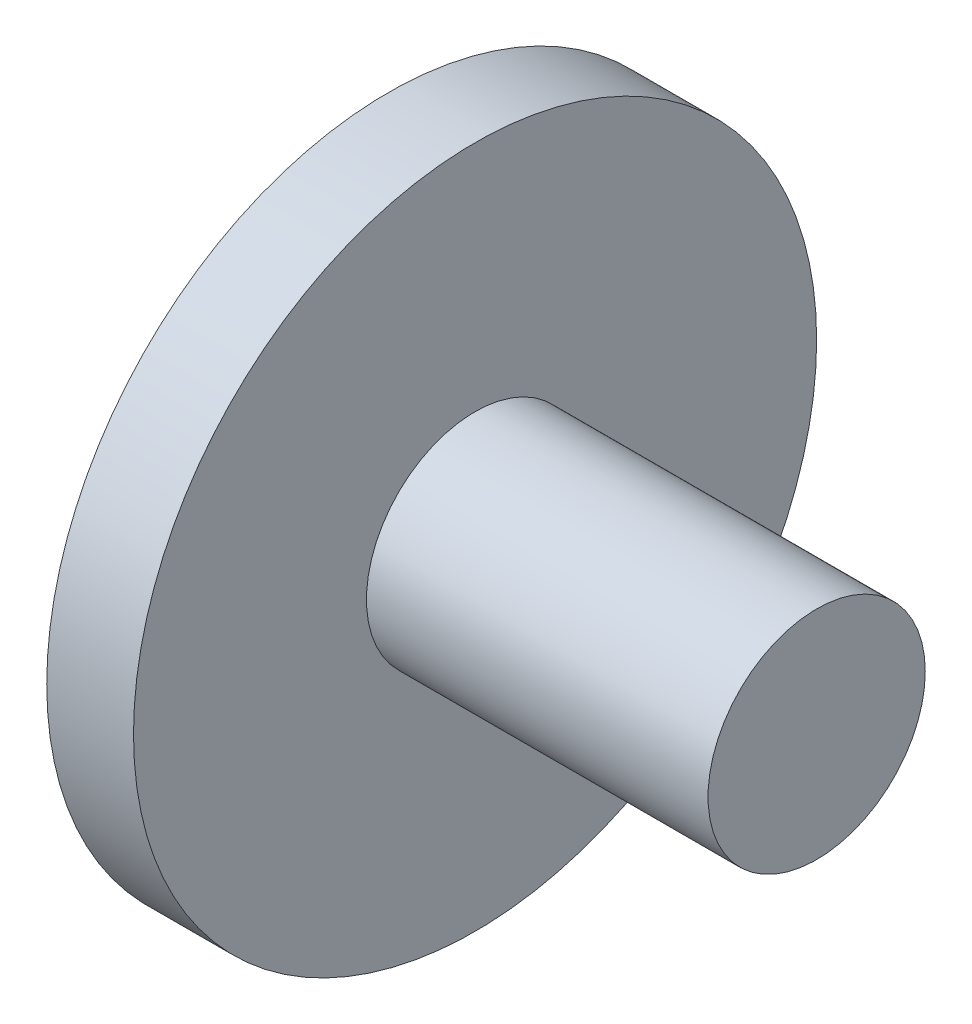
from build123d import *

# Parameters (mm, degrees)
SKETCH1_R           = 50
BOSS_EXTRUDE1_DEPTH = 12.7
SKETCH3_R           = 15.898868478
BOSS_EXTRUDE2_DEPTH = 50


with BuildPart() as part:
    # Sketch1 → Boss-Extrude1 (new body)
    with BuildSketch(Plane.YZ):
        with Locations(Location((0, 0, 0), (0, 0, 270))):
            Circle(SKETCH1_R)
    extrude(amount=-BOSS_EXTRUDE1_DEPTH)

    # Sketch3 → Boss-Extrude2 (add)
    with BuildSketch(Plane(origin=(0, 0, 0), x_dir=(0, 0, -1), z_dir=(1, 0, 0))):
        Circle(SKETCH3_R)
    extrude(amount=BOSS_EXTRUDE2_DEPTH)


solid = part.part
